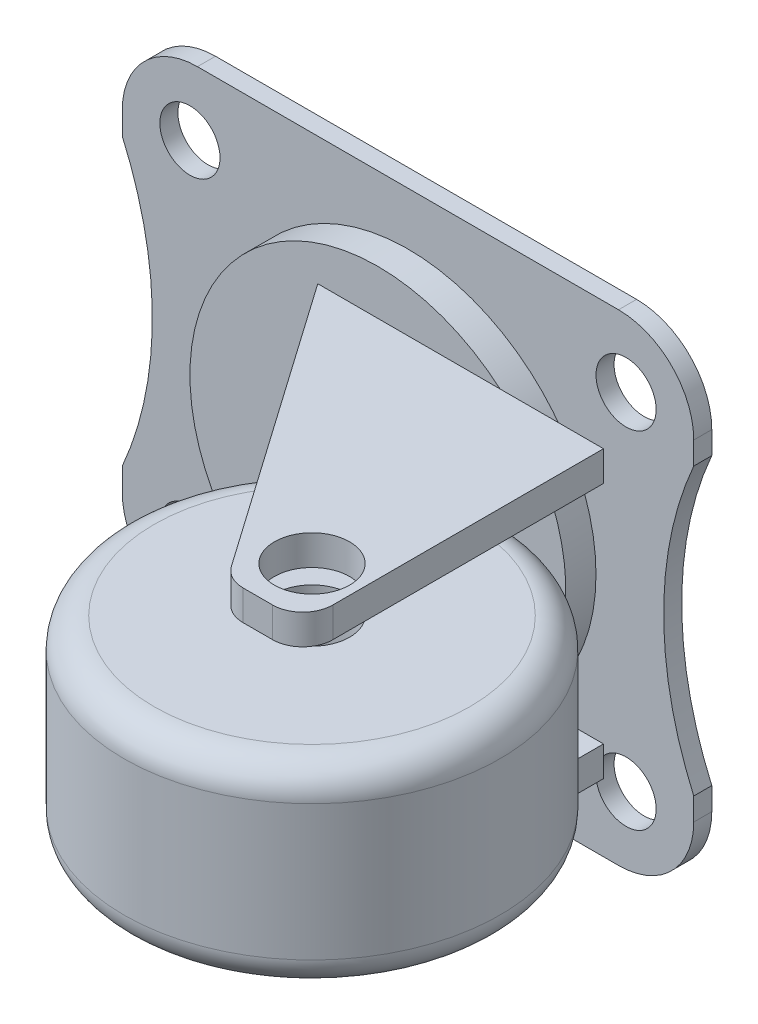
from build123d import *

# Parameters (mm, degrees)
SKETCH_1_W          = 50
SKETCH_1_H          = 50
EXTRUDE_1_DEPTH     = 1.2
SKETCH_2_W          = 50
SKETCH_2_H          = 50
SKETCH_2_R          = 2
CUT_EXTRUDE_1_DEPTH = 1.2
FILLET_3_R          = 5
SKETCH_3_R          = 12.5
EXTRUDE_2_DEPTH     = 2
SKETCH_4_W          = 25
SKETCH_4_H          = 2
EXTRUDE_3_DEPTH     = 20
CUT_EXTRUDE_2_DEPTH = 23
SKETCH_6_R          = 12.5
SKETCH_6_R_2        = 2.5
EXTRUDE_4_DEPTH     = 6.5
FILLET_4_R          = 2
FILLET_5_R          = 2
SKETCH_7_R          = 2.5
CUT_EXTRUDE_3_DEPTH = 21


with BuildPart() as part:
    # 草图1 → 凸台-拉伸1 (new body)
    with BuildSketch(Plane.XY):
        with Locations((25, -25)):
            Rectangle(SKETCH_1_W, SKETCH_1_H)
    extrude(amount=EXTRUDE_1_DEPTH)

    # 草图2 → 切除-拉伸1 (cut)
    # profile 1 of 5: a face of its own
    with BuildSketch(Plane.XY.offset(1.2)):
        with Locations((25, -25)):
            Rectangle(SKETCH_2_W, SKETCH_2_H)
        with BuildLine():
            ThreePointArc((6, -15.5), (8, -25), (6, -34.5))
            Line((6, -34.5), (6, -41))
            Line((6, -41), (44, -41))
            Line((44, -41), (44, -34.5))
            ThreePointArc((44, -34.5), (42, -25), (44, -15.5))
            Line((44, -15.5), (44, -9))
            Line((44, -9), (6, -9))
            Line((6, -9), (6, -15.5))
        make_face(mode=Mode.SUBTRACT)
    # profile 2 of 5: a face of its own
    with BuildSketch(Plane.XY.offset(1.2)):
        with Locations((39.5, -13.5)):
            Circle(SKETCH_2_R)
    # profile 3 of 5: a face of its own
    with BuildSketch(Plane.XY.offset(1.2)):
        with Locations((10.5, -36.5)):
            Circle(SKETCH_2_R)
    # profile 4 of 5: a face of its own
    with BuildSketch(Plane.XY.offset(1.2)):
        with Locations((10.5, -13.5)):
            Circle(SKETCH_2_R)
    # profile 5 of 5: a face of its own
    with BuildSketch(Plane.XY.offset(1.2)):
        with Locations((39.5, -36.5)):
            Circle(SKETCH_2_R)
    extrude(amount=-CUT_EXTRUDE_1_DEPTH, mode=Mode.SUBTRACT)

    # 圆角3
    fillet_3_edges = [part.edges().sort_by_distance(p)[0] for p in [
        (6, -41, 0.6),
        (44, -41, 0.6),
        (44, -9, 0.6),
        (6, -9, 0.6),
    ]]
    fillet(fillet_3_edges, radius=FILLET_3_R)

    # 草图3 → 凸台-拉伸2 (add)
    with BuildSketch(Plane.XY.offset(1.2)):
        with Locations((25, -25)):
            Circle(SKETCH_3_R)
    extrude(amount=EXTRUDE_2_DEPTH)

    # 草图4 → 凸台-拉伸3 (add)
    with BuildSketch(Plane.XY.offset(3.2)):
        with Locations((27.5, -33.5)):
            Rectangle(SKETCH_4_W, SKETCH_4_H)
        with Locations((27.5, -16.5)):
            Rectangle(SKETCH_4_W, SKETCH_4_H)
    extrude(amount=EXTRUDE_3_DEPTH)

    # 草图5 → 切除-拉伸2 (cut)
    with BuildSketch(Plane.XZ.offset(34.5)):
        Polygon((35, 23.2), (21, 3.2), (15, 3.2), (15, 23.2), align=None)
    extrude(amount=-CUT_EXTRUDE_2_DEPTH, mode=Mode.SUBTRACT)

    # 圆角5
    fillet_5_edges = [part.edges().sort_by_distance(p)[0] for p in [
        (40, -33.5, 23.2),
        (40, -16.5, 23.2),
        (35, -16.5, 23.2),
        (35, -33.5, 23.2),
    ]]
    fillet(fillet_5_edges, radius=FILLET_5_R)

    # 草图7 → 切除-拉伸3 (cut)
    with BuildSketch(Plane.XZ.offset(34.5)):
        with Locations(Location((36.916887115, 19.5, 0), (0, 0, 270))):
            Circle(SKETCH_7_R)
    extrude(amount=-CUT_EXTRUDE_3_DEPTH, mode=Mode.SUBTRACT)


with BuildPart() as body_2:
    # 草图6 → 凸台-拉伸4 (new, symmetric)
    with BuildSketch(Plane(origin=(0, -25, 0), x_dir=(1, 0, 0), z_dir=(0, 1, 0))):
        with Locations(Location((36.916887115, -19.5, 0), (0, 0, 90))):
            Circle(SKETCH_6_R)
        with Locations(Location((36.916887115, -19.5, 0), (0, 0, 90))):
            Circle(SKETCH_6_R_2, mode=Mode.SUBTRACT)
    extrude(amount=EXTRUDE_4_DEPTH, both=True)

    # 圆角4
    fillet_4_edges = [body_2.edges().sort_by_distance(p)[0] for p in [
        (36.916887115, -31.5, 32),
        (36.916887115, -18.5, 32),
    ]]
    fillet(fillet_4_edges, radius=FILLET_4_R)


solid = Compound([part.part, body_2.part])
